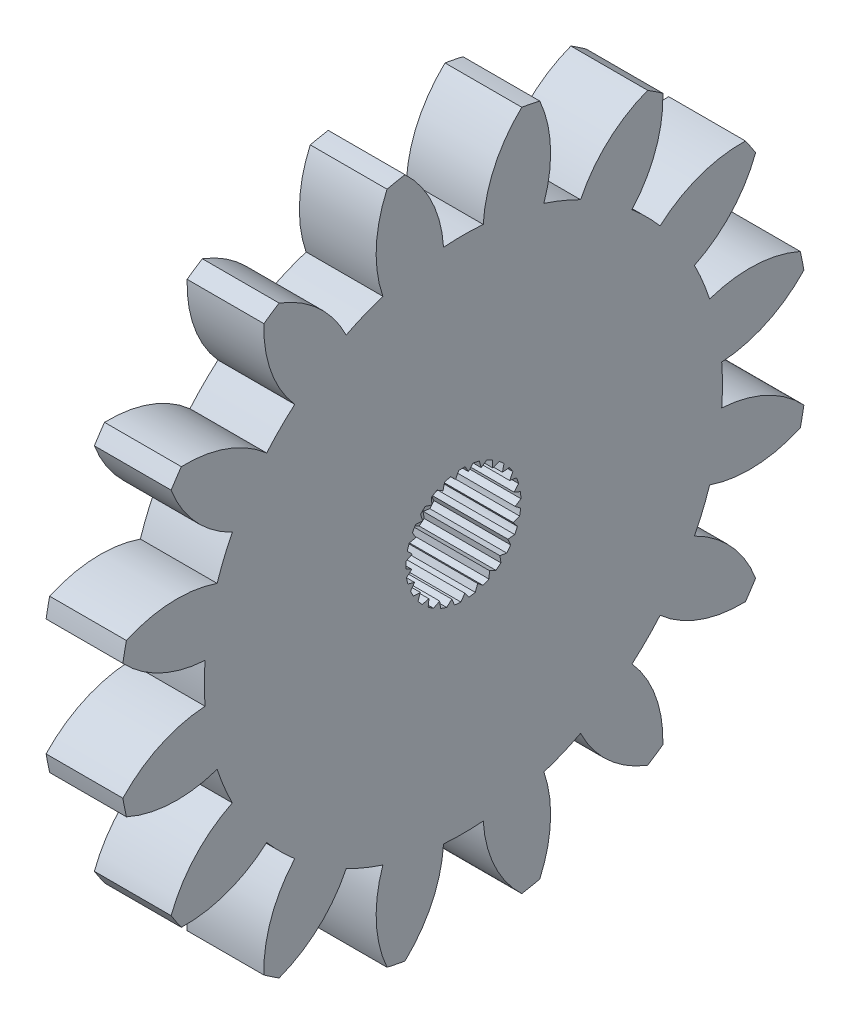
from build123d import *

# Parameters (mm, degrees)
BASPROSKE_W             = 4
BASPROSKE_H             = 18
TOOTHCUT_DEPTH          = 26.768197453
TEETHCUTS_COUNT         = 16
TEETHCUTS_ANGLE         = 337.5
BORSKE_R                = 3
BORE_DEPTH              = 50.0000508
SALIENTE_EXTRUIR2_DEPTH = 4
MATRIZC1_COUNT          = 25
CROQUIS5_R              = 4
CROQUIS5_R_2            = 1.5
SALIENTE_EXTRUIR3_DEPTH = 2
CROQUIS6_R              = 2.85
CORTAR_EXTRUIR4_DEPTH   = 0.8


with BuildPart() as part:
    # BasProSke → Base-Revolve (revolve)
    with BuildSketch(Plane(origin=(0, 0, 0), x_dir=(1, 0, 0), z_dir=(0, 1, 0)), mode=Mode.PRIVATE) as base_revolve_sk:
        with Locations((2, 9)):
            Rectangle(BASPROSKE_W, BASPROSKE_H)
    revolve(base_revolve_sk.sketch.rotate(Axis((-10, 0, 0), (1, 0, 0)), 180), axis=Axis((-10, 0, 0), (1, 0, 0)))

    # TooCutSke → ToothCut (cut, through all)
    with BuildSketch(Plane(origin=(0, 0, 0), x_dir=(0, 0, -1), z_dir=(1, 0, 0))):
        with BuildLine():
            ThreePointArc((1.03434411, 13.459313997), (0, 13.499), (-1.03434411, 13.459313997))
            ThreePointArc((-1.03434411, 13.459313997), (-1.635143665, 15.806872195), (-3.065655864, 17.762792553))
            ThreePointArc((-3.065655864, 17.762792553), (0, 18.0254), (3.065655864, 17.762792553))
            ThreePointArc((3.065655864, 17.762792553), (1.635143665, 15.806872195), (1.03434411, 13.459313997))
        make_face()
    toothcut = extrude(amount=TOOTHCUT_DEPTH, mode=Mode.SUBTRACT)

    # TeethCuts: ToothCut ×16 about axis
    teethcuts_axis = Axis((-10, 0, 0), (1, 0, 0))
    for i in range(1, TEETHCUTS_COUNT):
        add(toothcut.rotate(teethcuts_axis, i * TEETHCUTS_ANGLE / (TEETHCUTS_COUNT - 1)), mode=Mode.SUBTRACT)

    # BorSke → Bore (cut, symmetric)
    with BuildSketch(Plane(origin=(0, 0, 0), x_dir=(0, 0, -1), z_dir=(1, 0, 0))):
        with Locations(Location((0, 0, 0), (0, 0, 180))):
            Circle(BORSKE_R)
    extrude(amount=BORE_DEPTH, both=True, mode=Mode.SUBTRACT)

    # Croquis4 → Saliente-Extruir2 (add, through all)
    with BuildSketch(Plane.ZY):
        with BuildLine():
            Line((-0.266547398, 2.686810839), (-0.504049329, 2.957352579))
            ThreePointArc((-0.504049329, 2.957352579), (-0.296163775, 2.985345377), (-0.08683031, 2.998743153))
            Line((-0.08683031, 2.998743153), (-0.266547398, 2.686810839))
        make_face()
    saliente_extruir2 = extrude(amount=-SALIENTE_EXTRUIR2_DEPTH)

    # MatrizC1: Saliente-Extruir2 ×25 about axis
    matrizc1_axis = Axis((0, 0, 0), (1, 0, 0))
    for i in range(1, MATRIZC1_COUNT):
        add(saliente_extruir2.rotate(matrizc1_axis, i * 360 / MATRIZC1_COUNT))

    # Croquis5 → Saliente-Extruir3 (add)
    with BuildSketch(Plane.ZY):
        with Locations(Location((0, 0, 0), (0, 0, 180))):
            Circle(CROQUIS5_R)
        Circle(CROQUIS5_R_2, mode=Mode.SUBTRACT)
    extrude(amount=SALIENTE_EXTRUIR3_DEPTH)

    # Croquis6 → Cortar-Extruir4 (cut)
    with BuildSketch(Plane.ZY.offset(2)):
        Circle(CROQUIS6_R)
    extrude(amount=-CORTAR_EXTRUIR4_DEPTH, mode=Mode.SUBTRACT)


solid = part.part
